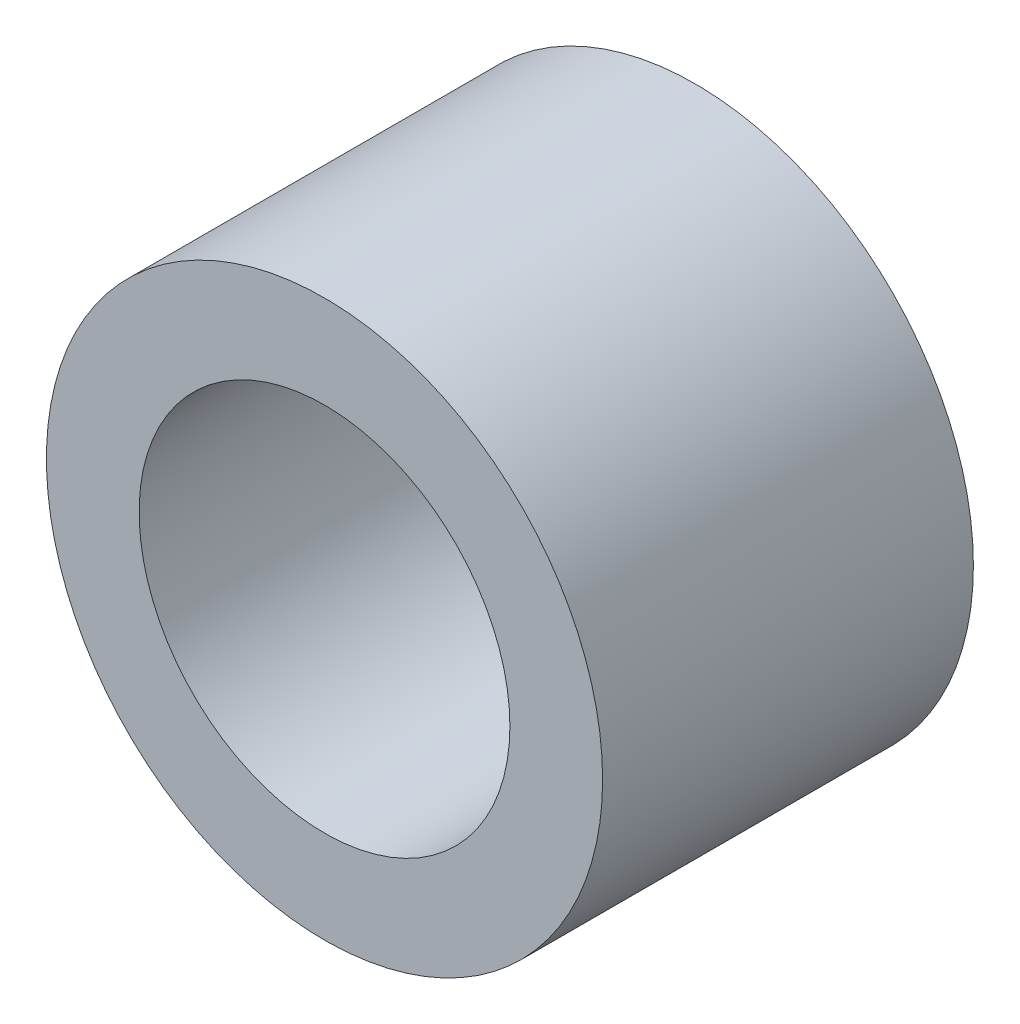
from build123d import *

# Parameters (mm, degrees)
SKETCH1_R           = 7.5
SKETCH1_R_2         = 5
BOSS_EXTRUDE1_DEPTH = 5


with BuildPart() as part:
    # Sketch1 → Boss-Extrude1 (new, symmetric)
    with BuildSketch(Plane.XY):
        Circle(SKETCH1_R)
        Circle(SKETCH1_R_2, mode=Mode.SUBTRACT)
    extrude(amount=BOSS_EXTRUDE1_DEPTH, both=True)


solid = part.part
